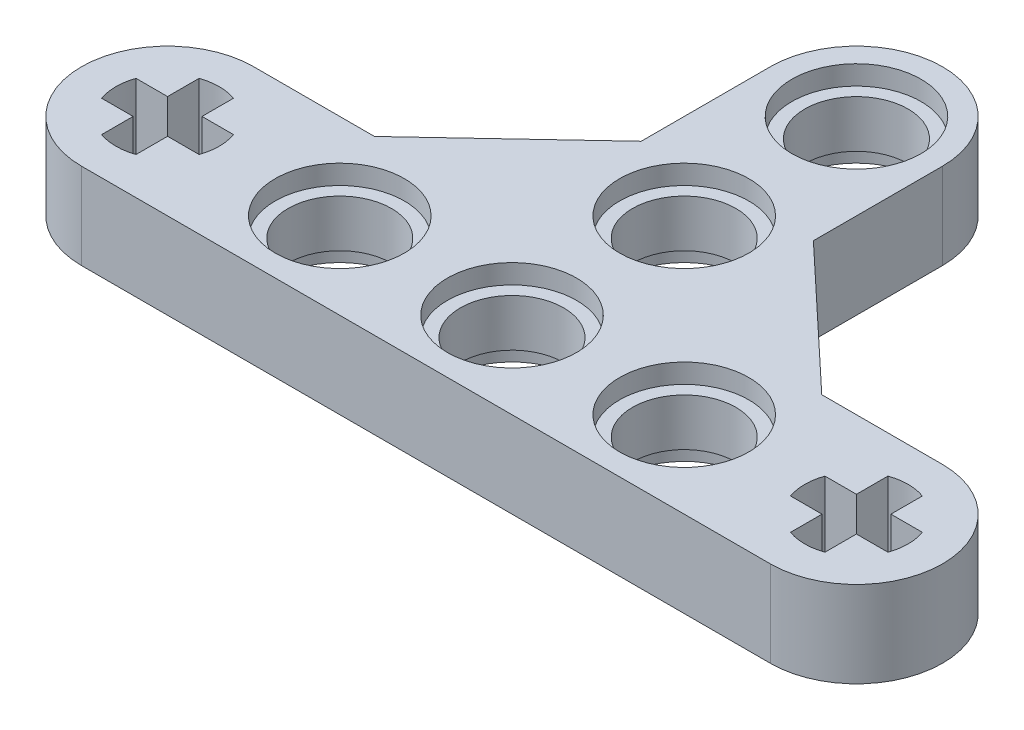
from build123d import *

# Parameters (mm, degrees)
SKETCH_1_R          = 2.4
EXTRUDE_1_DEPTH     = 4
SKETCH_2_R          = 3
CUT_EXTRUDE_1_DEPTH = 0.9
EXTRUDE_START       = -4
EXTRUDE_2_DEPTH     = 4


with BuildPart() as part:
    # 草图1 → 凸台-拉伸1 (new body)
    with BuildSketch(Plane(origin=(0, 0, 0), x_dir=(1, 0, 0), z_dir=(0, 1, 0))):
        with BuildLine():
            Line((-16, 4), (-10.388851415, 4))
            Line((-10.388851415, 4), (-4, 10))
            Line((-4, 10), (-4, 16))
            ThreePointArc((-4, 16), (0, 20), (4, 16))
            Line((4, 16), (4, 10))
            Line((4, 10), (10.388851415, 4))
            Line((10.388851415, 4), (16, 4))
            ThreePointArc((16, 4), (20, 0), (16, -4))
            Line((16, -4), (-16, -4))
            ThreePointArc((-16, -4), (-20, 0), (-16, 4))
        make_face()
        with Locations(Location((16, 0, 0), (0, 0, 270))):
            Circle(SKETCH_1_R, mode=Mode.SUBTRACT)
        with Locations(Location((8, 0, 0), (0, 0, 270))):
            Circle(SKETCH_1_R, mode=Mode.SUBTRACT)
        with Locations(Location((0, 0, 0), (0, 0, 270))):
            Circle(SKETCH_1_R, mode=Mode.SUBTRACT)
        with Locations(Location((-8, 0, 0), (0, 0, 270))):
            Circle(SKETCH_1_R, mode=Mode.SUBTRACT)
        with Locations(Location((-16, 0, 0), (0, 0, 270))):
            Circle(SKETCH_1_R, mode=Mode.SUBTRACT)
        with Locations(Location((0, 8, 0), (0, 0, 270))):
            Circle(SKETCH_1_R, mode=Mode.SUBTRACT)
        with Locations(Location((0, 16, 0), (0, 0, 270))):
            Circle(SKETCH_1_R, mode=Mode.SUBTRACT)
    extrude(amount=EXTRUDE_1_DEPTH)

    # 草图2 → 切除-拉伸1 (cut)
    with BuildSketch(Plane(origin=(0, 4, 0), x_dir=(1, 0, 0), z_dir=(0, 1, 0))):
        with Locations(Location((-8, 0, 0), (0, 0, 270))):
            Circle(SKETCH_2_R)
        with Locations(Location((0, 0, 0), (0, 0, 270))):
            Circle(SKETCH_2_R)
        with Locations(Location((8, 0, 0), (0, 0, 270))):
            Circle(SKETCH_2_R)
        with Locations(Location((0, 8, 0), (0, 0, 270))):
            Circle(SKETCH_2_R)
        with Locations(Location((0, 16, 0), (0, 0, 270))):
            Circle(SKETCH_2_R)
    cut_extrude_1 = extrude(amount=-CUT_EXTRUDE_1_DEPTH, mode=Mode.SUBTRACT)

    # 镜向1: 切除-拉伸1 across plane
    add(cut_extrude_1.mirror(Plane.ZX.offset(2)), mode=Mode.SUBTRACT)

    # 草图4 → 凸台-拉伸2 (add)
    with BuildSketch(Plane(origin=(0, 4, 0), x_dir=(1, 0, 0), z_dir=(0, 1, 0)).offset(EXTRUDE_START)):
        with BuildLine():
            Line((-16.8, 0.8), (-16.8, 2.2627417))
            ThreePointArc((-16.8, 2.2627417), (-17.697056275, 1.697056275), (-18.2627417, 0.8))
            Line((-18.2627417, 0.8), (-16.8, 0.8))
        make_face()
        with BuildLine():
            ThreePointArc((-13.7372583, 0.8), (-14.302943725, 1.697056275), (-15.2, 2.2627417))
            Line((-15.2, 2.2627417), (-15.2, 0.8))
            Line((-15.2, 0.8), (-13.7372583, 0.8))
        make_face()
        with BuildLine():
            Line((-13.7372583, -0.8), (-15.2, -0.8))
            Line((-15.2, -0.8), (-15.2, -2.2627417))
            ThreePointArc((-15.2, -2.2627417), (-14.302943725, -1.697056275), (-13.7372583, -0.8))
        make_face()
        with BuildLine():
            Line((-16.8, -2.2627417), (-16.8, -0.8))
            Line((-16.8, -0.8), (-18.2627417, -0.8))
            ThreePointArc((-18.2627417, -0.8), (-17.697056275, -1.697056275), (-16.8, -2.2627417))
        make_face()
        with BuildLine():
            Line((13.7372583, 0.8), (15.2, 0.8))
            Line((15.2, 0.8), (15.2, 2.2627417))
            ThreePointArc((15.2, 2.2627417), (14.302943725, 1.697056275), (13.7372583, 0.8))
        make_face()
        with BuildLine():
            Line((16.8, 0.8), (18.2627417, 0.8))
            ThreePointArc((18.2627417, 0.8), (17.697056275, 1.697056275), (16.8, 2.2627417))
            Line((16.8, 2.2627417), (16.8, 0.8))
        make_face()
        with BuildLine():
            Line((18.2627417, -0.8), (16.8, -0.8))
            Line((16.8, -0.8), (16.8, -2.2627417))
            ThreePointArc((16.8, -2.2627417), (17.697056275, -1.697056275), (18.2627417, -0.8))
        make_face()
        with BuildLine():
            Line((15.2, -2.2627417), (15.2, -0.8))
            Line((15.2, -0.8), (13.7372583, -0.8))
            ThreePointArc((13.7372583, -0.8), (14.302943725, -1.697056275), (15.2, -2.2627417))
        make_face()
    extrude(amount=EXTRUDE_2_DEPTH)


solid = part.part
